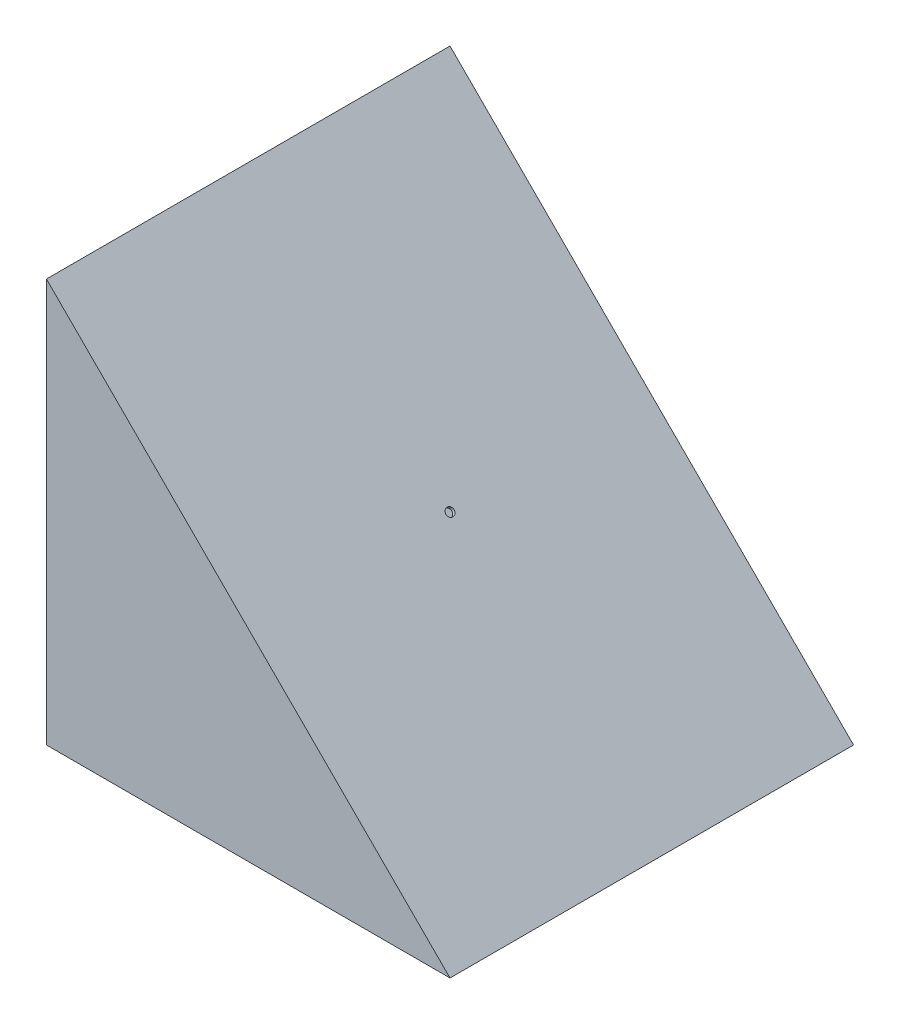
from build123d import *

# Parameters (mm, degrees)
RESSALTO_EXTRUS_O1_DEPTH = 50
ESBO_O2_W                = 5.2
ESBO_O2_H                = 2.5
ESBO_O2_W_2              = 2.5
ESBO_O2_H_2              = 5.2
CORTE_EXTRUS_O1_DEPTH    = 6
ESBO_O3_R                = 0.5
CORTE_EXTRUS_O2_DEPTH    = 0.4


with BuildPart() as part:
    # Esboço1 → Ressalto-extrusão1 (new body)
    with BuildSketch(Plane.XY):
        Polygon((0, 0), (0, 50), (50, 0), align=None)
    extrude(amount=RESSALTO_EXTRUS_O1_DEPTH)

    # Esboço2 → Corte-extrusão1 (cut)
    with BuildSketch(Plane.XZ):
        with Locations((25, 28.85)):
            Rectangle(ESBO_O2_W, ESBO_O2_H)
        with Locations((21.15, 25)):
            Rectangle(ESBO_O2_W_2, ESBO_O2_H_2)
        with Locations((25, 25)):
            Rectangle(ESBO_O2_W, ESBO_O2_H_2)
        with Locations((28.85, 25)):
            Rectangle(ESBO_O2_W_2, ESBO_O2_H_2)
        with Locations((25, 21.15)):
            Rectangle(ESBO_O2_W, ESBO_O2_H)
    extrude(amount=-CORTE_EXTRUS_O1_DEPTH, mode=Mode.SUBTRACT)

    # Esboço3 → Corte-extrusão2 (cut)
    with BuildSketch(Plane(origin=(25, 25, 0), x_dir=(0, 0, -1), z_dir=(0.7071067811865487, 0.7071067811865465, 0))):
        with Locations(Location((-25, 0, 0), (0, 0, 90))):
            Circle(ESBO_O3_R)
    extrude(amount=-CORTE_EXTRUS_O2_DEPTH, mode=Mode.SUBTRACT)


solid = part.part
